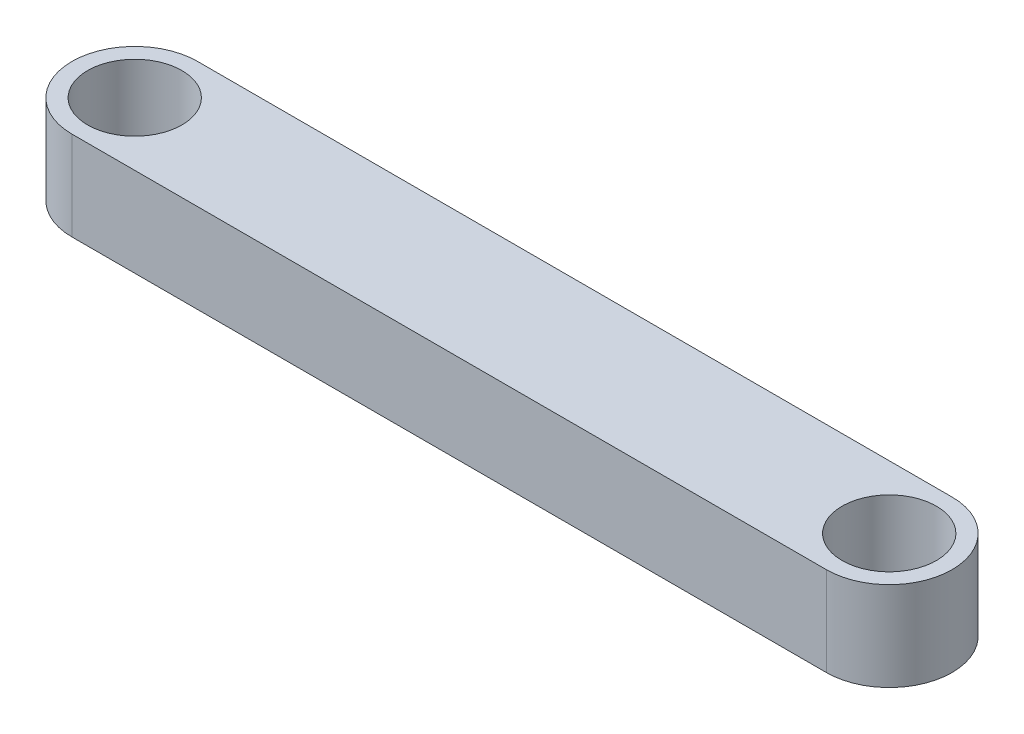
from build123d import *

# Parameters (mm, degrees)
SKETCH1_R           = 19.84375
BOSS_EXTRUDE1_DEPTH = 37.5


with BuildPart() as part:
    # Sketch1 → Boss-Extrude1 (new body)
    with BuildSketch(Plane(origin=(0, 0, 0), x_dir=(1, 0, 0), z_dir=(0, 1, 0))):
        with BuildLine():
            Line((-158.75, -26.458333333), (158.75, -26.458333333))
            ThreePointArc((158.75, -26.458333333), (185.208333333, 0), (158.75, 26.458333333))
            Line((158.75, 26.458333333), (-158.75, 26.458333333))
            ThreePointArc((-158.75, 26.458333333), (-185.208333333, 0), (-158.75, -26.458333333))
        make_face()
        with Locations(Location((-158.75, 0, 0), (0, 0, 270))):
            Circle(SKETCH1_R, mode=Mode.SUBTRACT)
        with Locations(Location((158.75, 0, 0), (0, 0, 270))):
            Circle(SKETCH1_R, mode=Mode.SUBTRACT)
    extrude(amount=BOSS_EXTRUDE1_DEPTH)


solid = part.part
